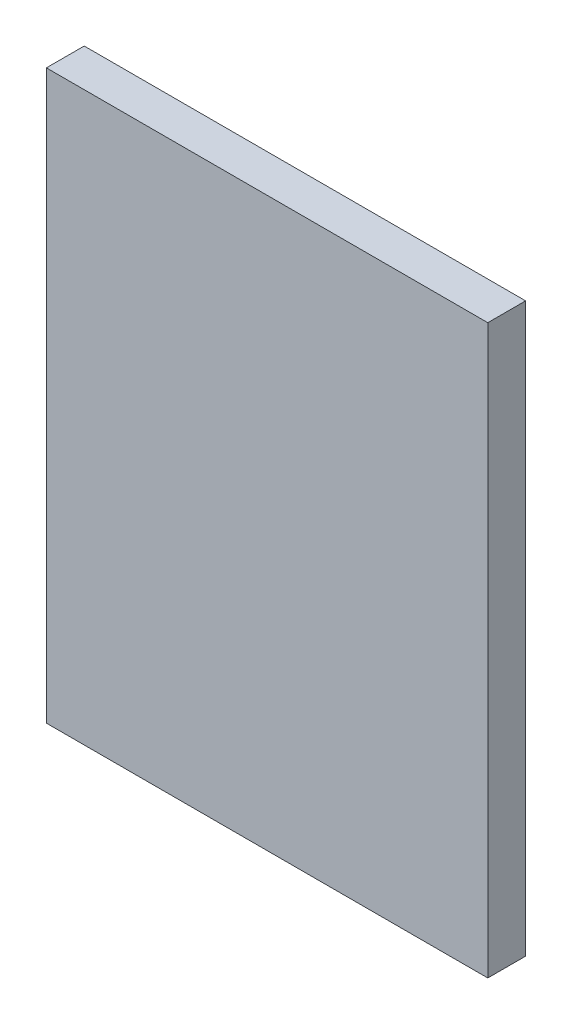
from build123d import *

# Parameters (mm, degrees)
SKETCH1_W           = 35
SKETCH1_H           = 45
BOSS_EXTRUDE1_DEPTH = 3


with BuildPart() as part:
    # Sketch1 → Boss-Extrude1 (new body)
    with BuildSketch(Plane.XY):
        Rectangle(SKETCH1_W, SKETCH1_H)
    extrude(amount=BOSS_EXTRUDE1_DEPTH)


solid = part.part
